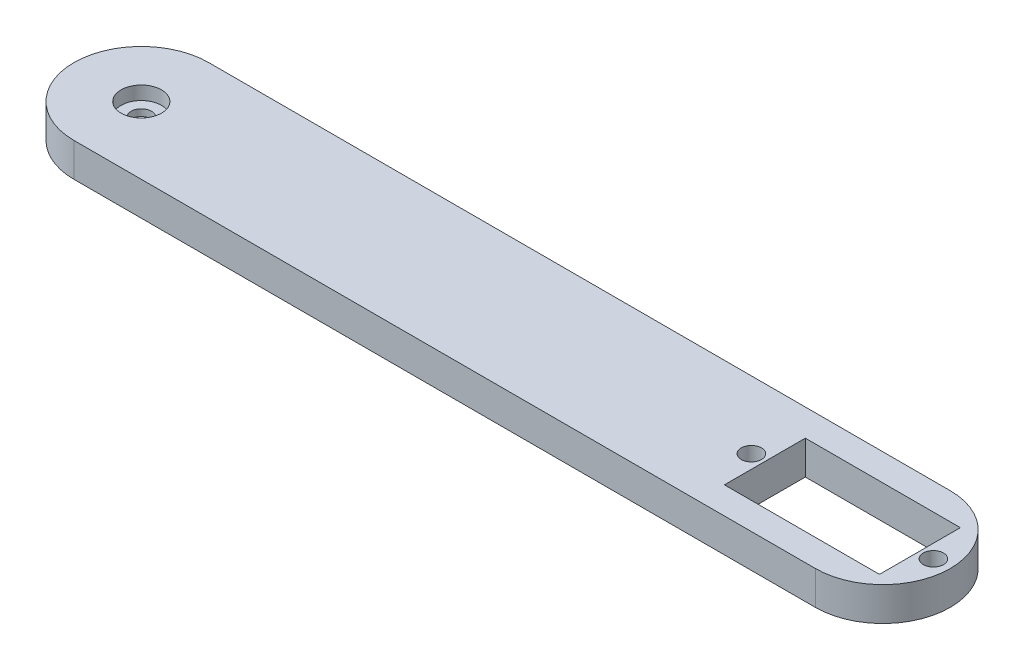
from build123d import *

# Parameters (mm, degrees)
BOSS_EXTRUDE1_DEPTH = 5
SKETCH3_W           = 17.5
SKETCH3_H           = 12
SKETCH3_W_2         = 5.5
SKETCH3_R           = 1.5
CUT_EXTRUDE1_DEPTH  = 81.777472107
SKETCH5_R           = 3
CUT_EXTRUDE2_DEPTH  = 2
CUT_EXTRUDE3_DEPTH  = 2
SKETCH8_R           = 1.5
CUT_EXTRUDE4_DEPTH  = 81.678373806


with BuildPart() as part:
    # Sketch1 → Boss-Extrude1 (new body)
    with BuildSketch(Plane(origin=(0, 0, 0), x_dir=(1, 0, 0), z_dir=(0, 1, 0))):
        with BuildLine():
            Line((-40, 10), (40, 10))
            ThreePointArc((40, 10), (50, 0), (40, -10))
            Line((40, -10), (-40, -10))
            Line((-40, -10), (-70, -10))
            ThreePointArc((-70, -10), (-80, 0), (-70, 10))
            Line((-70, 10), (-40, 10))
        make_face()
    extrude(amount=BOSS_EXTRUDE1_DEPTH)

    # Sketch3 → Cut-Extrude1 (cut, through all)
    with BuildSketch(Plane(origin=(0, 5, 0), x_dir=(1, 0, 0), z_dir=(0, 1, 0))):
        with Locations((31.25, 0)):
            Rectangle(SKETCH3_W, SKETCH3_H)
        with Locations((42.75, 0)):
            Rectangle(SKETCH3_W_2, SKETCH3_H)
        with Locations(Location((20.5, 0, 0), (0, 0, 270))):
            Circle(SKETCH3_R)
        with Locations(Location((47.5, 0, 0), (0, 0, 270))):
            Circle(SKETCH3_R)
    extrude(amount=-CUT_EXTRUDE1_DEPTH, mode=Mode.SUBTRACT)

    # Sketch5 → Cut-Extrude2 (cut)
    with BuildSketch(Plane(origin=(0, 5, 0), x_dir=(1, 0, 0), z_dir=(0, 1, 0))):
        with Locations(Location((-70, 0, 0), (0, 0, 270))):
            Circle(SKETCH5_R)
    extrude(amount=-CUT_EXTRUDE2_DEPTH, mode=Mode.SUBTRACT)

    # Sketch6 → Cut-Extrude3 (cut)
    with BuildSketch(Plane.XZ):
        with BuildLine():
            Line((-71.152960707, 6.396927513), (-78.631797828, 5.04896685))
            ThreePointArc((-78.631797828, 5.04896685), (-79.999926685, 0.038292326), (-78.670211746, -4.982712945))
            Line((-78.670211746, -4.982712945), (-70, -6.5))
            Line((-70, -6.5), (-50, -3))
            ThreePointArc((-50, -3), (-47, 0), (-50, 3))
            Line((-50, 3), (-68.847039198, 6.396927496))
            ThreePointArc((-68.847039198, 6.396927496), (-69.999999952, 6.5), (-71.152960707, 6.396927513))
        make_face()
    extrude(amount=-CUT_EXTRUDE3_DEPTH, mode=Mode.SUBTRACT)

    # Sketch8 → Cut-Extrude4 (cut, through all)
    with BuildSketch(Plane(origin=(0, 3, 0), x_dir=(1, 0, 0), z_dir=(0, 1, 0))):
        with Locations(Location((-70, 0, 0), (0, 0, 270))):
            Circle(SKETCH8_R)
    extrude(amount=-CUT_EXTRUDE4_DEPTH, mode=Mode.SUBTRACT)


solid = part.part
